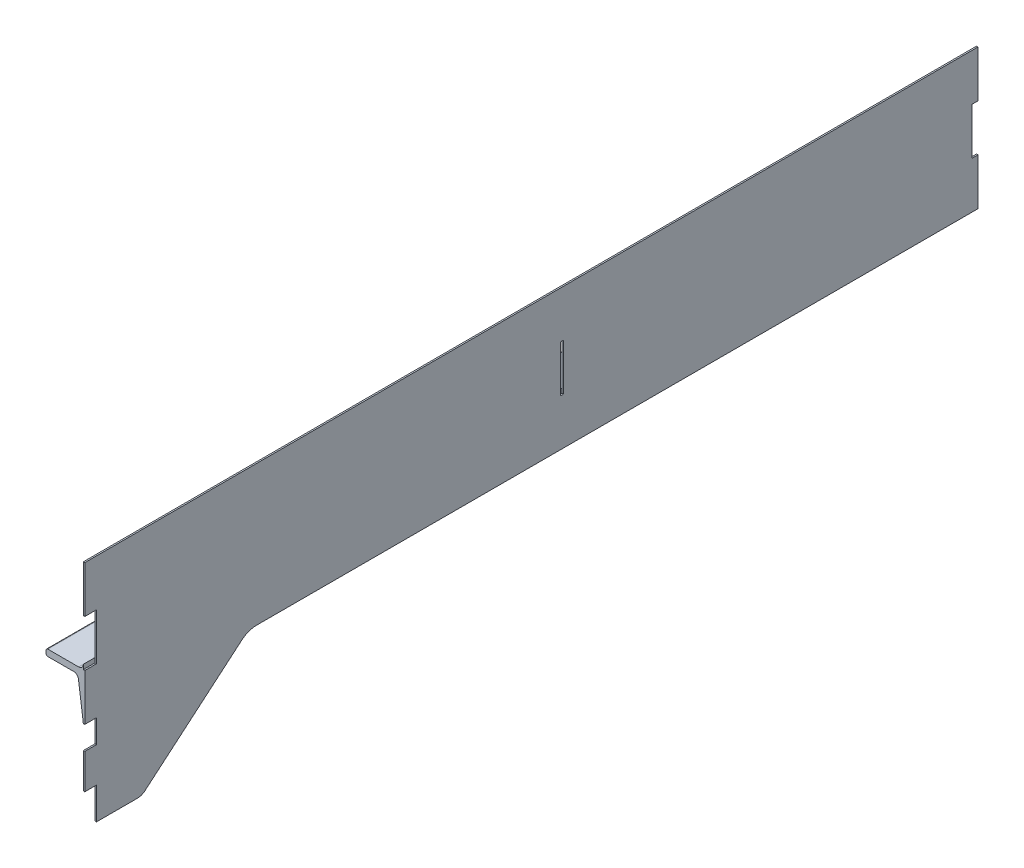
from build123d import *

# Parameters (mm, degrees)
SKETCH1_W           = 25.4
SKETCH1_H           = 1.5875
BOSS_EXTRUDE1_DEPTH = 0.79375
BOSS_EXTRUDE2_DEPTH = 482.6


with BuildPart() as part:
    # Sketch1 → Boss-Extrude1 (new body)
    # profile 1 of 2: a face of its own
    with BuildSketch(Plane(origin=(-94.488, 0, 0), x_dir=(0, -1, 0), z_dir=(-1, 0, 0))):
        Polygon((136.525, -196.85), (111.125, -196.85), (111.125, -203.2), (85.725, -203.2), (85.725, -196.85), (60.325, -196.85), (60.325, -682.625), (85.725, -682.625), (85.725, -679.45), (111.125, -679.45), (111.125, -682.625), (136.525, -682.625), align=None)
        with Locations((98.425, -456.40625)):
            Rectangle(SKETCH1_W, SKETCH1_H, mode=Mode.SUBTRACT)
    # profile 2 of 2: a face of its own
    with BuildSketch(Plane(origin=(-94.488, 0, 0), x_dir=(0, -1, 0), z_dir=(-1, 0, 0))):
        with BuildLine():
            Line((149.225, -203.2), (136.525, -203.2))
            Line((136.525, -203.2), (136.525, -290.406498707))
            ThreePointArc((136.525, -290.406498707), (137.30121982, -286.034603668), (139.534994681, -282.197126202))
            Line((139.534994681, -282.197126202), (184.118202659, -229.57294303))
            ThreePointArc((184.118202659, -229.57294303), (185.23509009, -227.654204297), (185.6232, -225.468256778))
            Line((185.6232, -225.468256778), (185.6232, -203.2))
            Line((185.6232, -203.2), (168.275, -203.2))
            Line((168.275, -203.2), (168.275, -196.85))
            Line((168.275, -196.85), (149.225, -196.85))
            Line((149.225, -196.85), (149.225, -203.2))
        make_face()
    extrude(amount=-BOSS_EXTRUDE1_DEPTH)

    # Sketch4 → Boss-Extrude2 (add)
    with BuildSketch(Plane(origin=(0, 0, -679.45), x_dir=(-1, 0, 0), z_dir=(0, 0, -1))):
        with BuildLine():
            Line((97.166105032, -116.822884411), (94.488, -136.525))
            Line((94.488, -136.525), (94.488, -114.25313135))
            Line((94.488, -114.25313135), (94.488, -111.125))
            Line((94.488, -111.125), (94.488, -108.585))
            ThreePointArc((94.488, -108.585), (95.231948776, -110.381051224), (97.028, -111.125))
            Line((97.028, -111.125), (113.793536469, -111.125))
            ThreePointArc((113.793536469, -111.125), (114.50064325, -111.417893219), (114.793536469, -112.125))
            Line((114.793536469, -112.125), (114.793536469, -113.625))
            ThreePointArc((114.793536469, -113.625), (114.50064325, -114.332106781), (113.793536469, -114.625))
            Line((113.793536469, -114.625), (99.682959601, -114.625))
            ThreePointArc((99.682959601, -114.625), (98.012237242, -115.251812399), (97.166105032, -116.822884411))
        make_face()
    extrude(amount=-BOSS_EXTRUDE2_DEPTH)


solid = part.part
